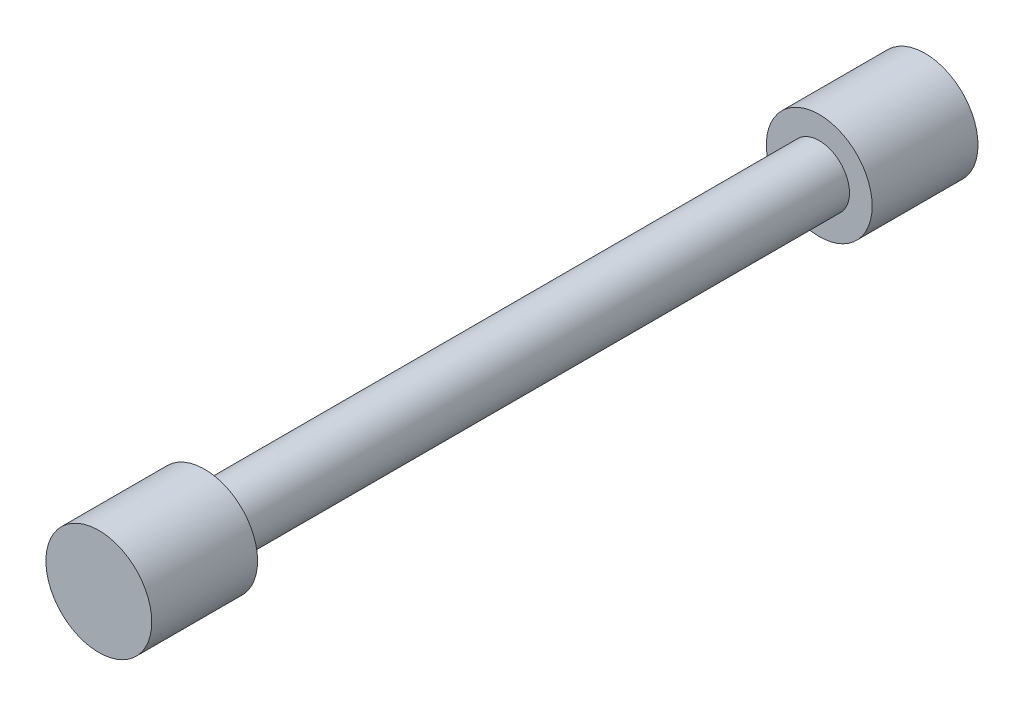
from build123d import *


with BuildPart() as part:
    # SK_Rod → Rod_Body (revolve)
    with BuildSketch(Plane(origin=(0, 0, 0), x_dir=(1, 0, 0), z_dir=(0, 1, 0))):
        Polygon((0, -7), (7, -7), (7, 7), (4, 7), (4, 88.289033997), (7, 88.289033997), (7, 102.289033997), (0, 102.289033997), align=None)
    revolve(axis=Axis((0, 0, 10), (0, 0, -1)))


solid = part.part
